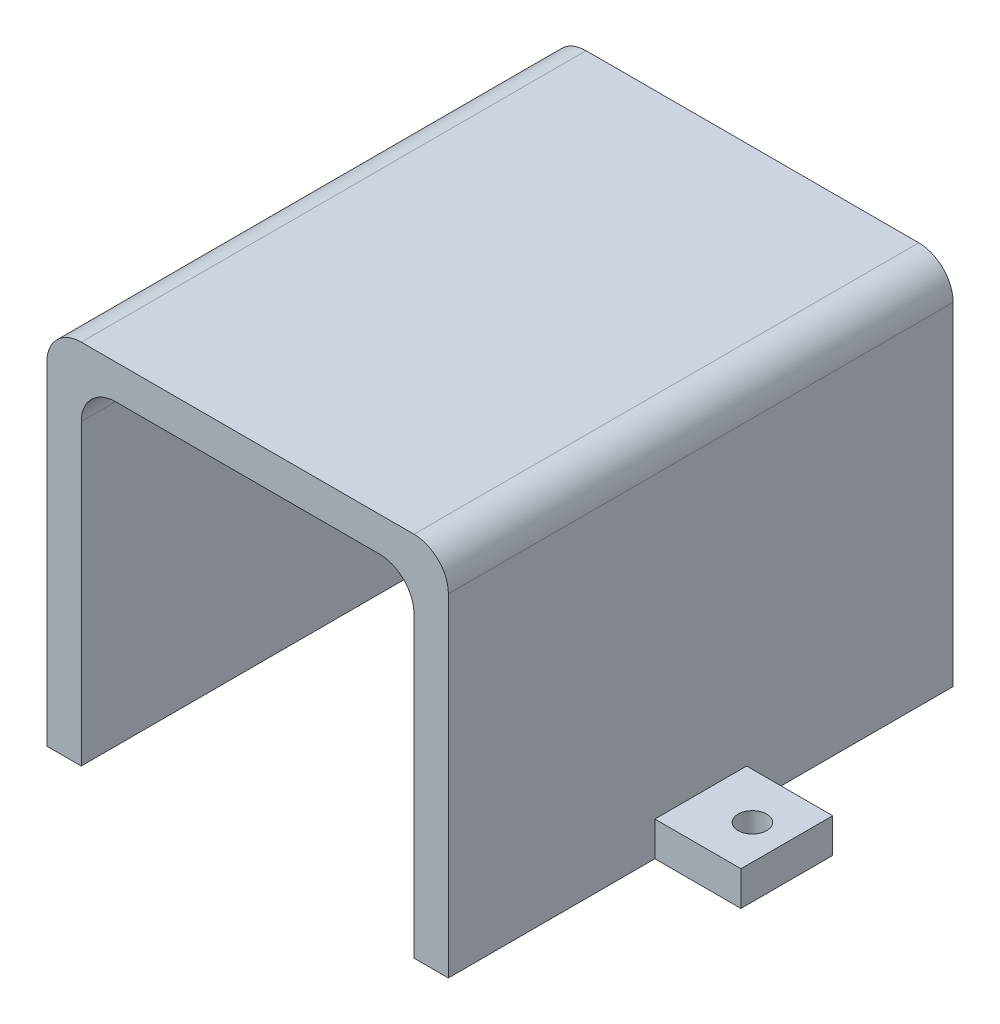
from build123d import *

# Parameters (mm, degrees)
BOSS_EXTRUDE1_DEPTH            = 22
SKETCH2_W                      = 7.5
SKETCH2_H                      = 8
SKETCH2_R                      = 0.5
BOSS_EXTRUDE2_DEPTH            = 3
BOSS_EXTRUDE2_2_DEPTH          = 3
FILLET1_R                      = 3
M3X0_5_TAPPED_HOLE1_AT_2_COUNT = 2
M3X0_5_TAPPED_HOLE1_AT_2_PITCH = 44


with BuildPart() as part:
    # Sketch1 → Boss-Extrude1 (new, symmetric)
    with BuildSketch(Plane.XY):
        Polygon((-17.5, -15), (-17.5, 17), (17.5, 17), (17.5, -15), (14.5, -15), (14.5, 14), (-14.5, 14), (-14.5, -15), align=None)
    extrude(amount=BOSS_EXTRUDE1_DEPTH, both=True)

    # Fillet1
    fillet1_edges = [part.edges().sort_by_distance(p)[0] for p in [
        (14.5, 14, 0),
        (-14.5, 14, 0),
        (-17.5, 17, 0),
        (17.5, 17, 0),
    ]]
    fillet(fillet1_edges, radius=FILLET1_R)


with BuildPart() as body_2:
    # Sketch2 → Boss-Extrude2 (new body)
    with BuildSketch(Plane(origin=(0, -15, 0), x_dir=(-1, 0, 0), z_dir=(0, -1, 0))):
        with Locations((-21.25, 0)):
            Rectangle(SKETCH2_W, SKETCH2_H)
        with Locations(Location((-22, 0, 0), (0, 0, 90))):
            Circle(SKETCH2_R, mode=Mode.SUBTRACT)
    extrude(amount=-BOSS_EXTRUDE2_DEPTH)


with BuildPart() as body_3:
    # Sketch2 → Boss-Extrude2 2 (new body)
    with BuildSketch(Plane(origin=(0, -15, 0), x_dir=(-1, 0, 0), z_dir=(0, -1, 0))):
        with Locations((21.25, 0)):
            Rectangle(SKETCH2_W, SKETCH2_H)
        with Locations(Location((22, 0, 0), (0, 0, 270))):
            Circle(SKETCH2_R, mode=Mode.SUBTRACT)
    extrude(amount=-BOSS_EXTRUDE2_2_DEPTH)

    # Sketch5 → M3x0.5 Tapped Hole1 (revolve, cut)
    with BuildSketch(Plane(origin=(-22, -15, 0), x_dir=(0, 0, -1), z_dir=(1, 0, 0))):
        Polygon((0, 0), (0, 3.751075774), (1.25, 3), (1.25, 0), align=None)
    m3x0_5_tapped_hole1 = revolve(axis=Axis((-22, -21.35, 0), (0, 1, 0)), mode=Mode.SUBTRACT)


with BuildPart() as body_2_1:
    add(body_2.part)

    # M3x0.5 Tapped Hole1 at 2: M3x0.5 Tapped Hole1 ×2
    with Locations(*[(i * M3X0_5_TAPPED_HOLE1_AT_2_PITCH, 0, 0) for i in range(1, M3X0_5_TAPPED_HOLE1_AT_2_COUNT)]):
        add(m3x0_5_tapped_hole1, mode=Mode.SUBTRACT)


solid = Compound([part.part, body_3.part, body_2_1.part])
